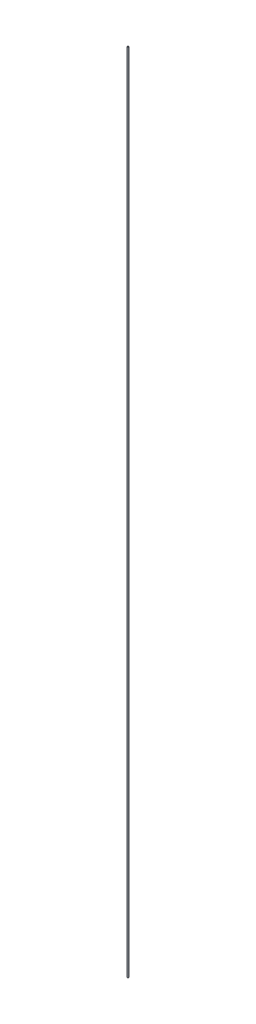
from build123d import *

# Parameters (mm, degrees)
SWEEP1_PROFILE_R = 6.35


with BuildPart() as part:
    # Sweep1: sweep along a path in Sketch1
    with BuildLine(Plane.XY) as sweep1_path:
        Line((0, 0), (0, 8507.984))
    # Sweep1 profile (on start of the path) → Sweep1 (sweep)
    with BuildSketch(Plane.ZX):
        Circle(SWEEP1_PROFILE_R)
    sweep(path=sweep1_path.line)


solid = part.part
